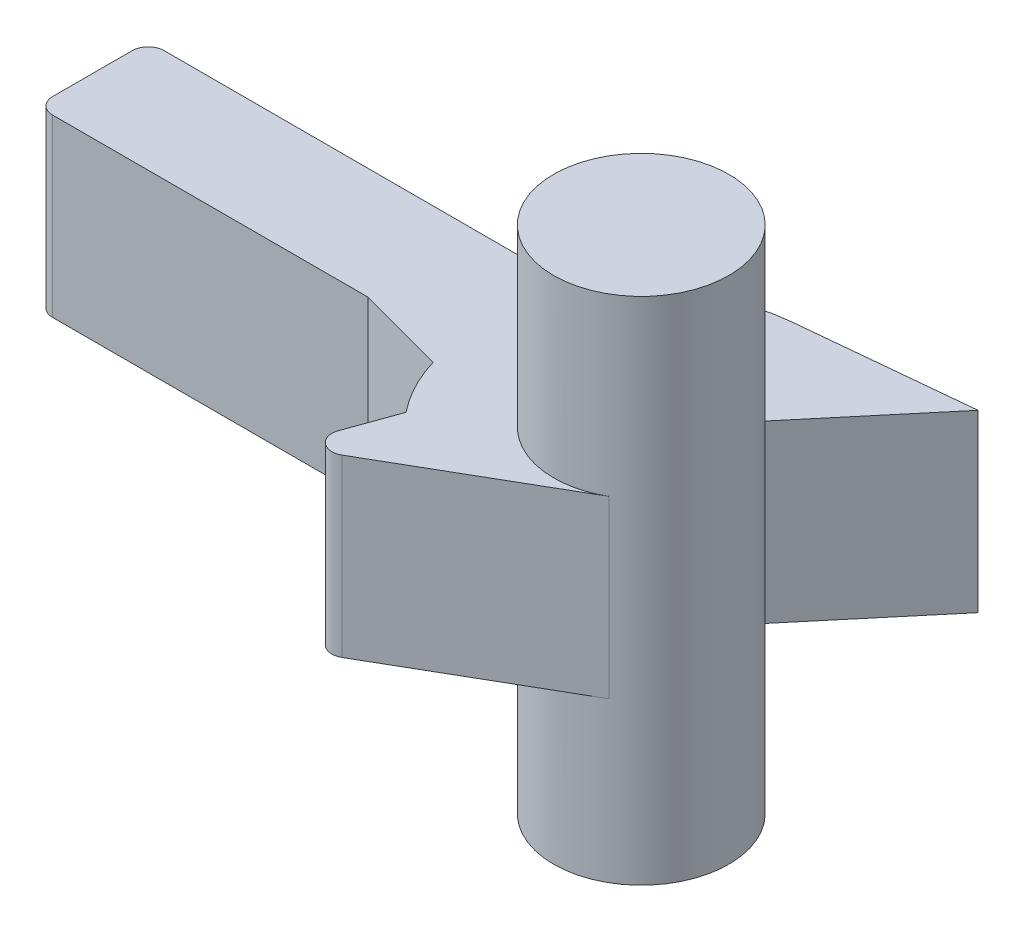
from build123d import *

# Parameters (mm, degrees)
BOSS_EXTRUDE1_DEPTH      = 2.2
BOSS_EXTRUDE2_DEPTH      = 4.4
BOSS_EXTRUDE2_DEPTH_BACK = 2
FILLET1_R                = 0.2


with BuildPart() as part:
    # Sketch1 → Boss-Extrude1 (new body)
    with BuildSketch(Plane(origin=(0, 0, 0), x_dir=(1, 0, 0), z_dir=(0, 1, 0))):
        with BuildLine():
            Line((-1.788854382, 1.1), (-7.288854382, 1.1))
            Line((-7.288854382, 1.1), (-7.288854382, -0.3))
            Line((-7.288854382, -0.3), (-3.130458393, -0.3))
            Line((-3.130458393, -0.3), (-2.012601597, -0.599528826))
            ThreePointArc((-2.012601597, -0.599528826), (-1.860410686, -0.974100652), (-1.639259655, -1.312565344))
            Line((-1.639259655, -1.312565344), (-2.048076211, -2.452627944))
            Line((-2.048076211, -2.452627944), (0.55, -0.952627944))
            ThreePointArc((0.55, -0.952627944), (1.095814168, -0.095871317), (0.707066371, 0.842648887))
            Line((0.707066371, 0.842648887), (1.928362829, 2.298133329))
            Line((1.928362829, 2.298133329), (-0.203939042, 2.09007389))
            ThreePointArc((-0.203939042, 2.09007389), (-1.112595158, 1.78104801), (-1.788854382, 1.1))
        make_face()
    extrude(amount=BOSS_EXTRUDE1_DEPTH)

    # Sketch1<3> → Boss-Extrude2 (add, two sides: drawn at the far end of the back side and taken through both)
    with BuildSketch(Plane(origin=(0, 0, 0), x_dir=(1, 0, 0), z_dir=(0, 1, 0)).offset(-BOSS_EXTRUDE2_DEPTH_BACK)):
        with BuildLine():
            ThreePointArc((1.1, 0), (0.996938566, 0.464880088), (0.707066371, 0.842648887))
            ThreePointArc((0.707066371, 0.842648887), (-1.095814168, 0.095871317), (0.55, -0.952627944))
            ThreePointArc((0.55, -0.952627944), (0.952627944, -0.55), (1.1, 0))
        make_face()
    extrude(amount=BOSS_EXTRUDE2_DEPTH + BOSS_EXTRUDE2_DEPTH_BACK)

    # Fillet1
    fillet1_edges = [part.edges().sort_by_distance(p)[0] for p in [
        (-2.048076211, 1.1, 2.452627944),
        (-7.288854382, 1.1, 0.3),
        (-7.288854382, 1.1, -1.1),
    ]]
    fillet(fillet1_edges, radius=FILLET1_R)


solid = part.part
